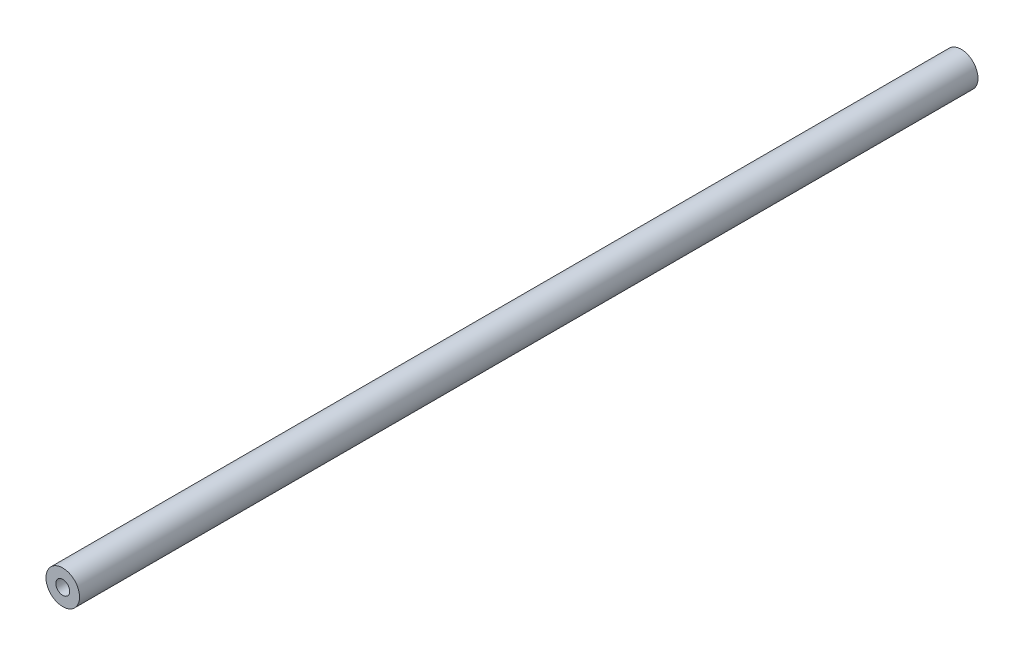
from build123d import *

# Parameters (mm, degrees)
SKETCH_1_R      = 4
EXTRUDE_1_DEPTH = 107
M4X0_71_D       = 3.3
M4X0_71_DEPTH   = 11
M4X0_71_TIP     = 0.991420021
M4X0_72_D       = 3.3
M4X0_72_DEPTH   = 11
M4X0_72_TIP     = 0.991420021


with BuildPart() as part:
    # Эскиз1 → Бобышка-Вытянуть1 (new, symmetric)
    with BuildSketch(Plane.XY):
        Circle(SKETCH_1_R)
    extrude(amount=EXTRUDE_1_DEPTH, both=True)

    # Отверстие обработанное метчиком M4x0.71
    with Locations(Plane(origin=(0, 0, -107), x_dir=(-1, 0, 0), z_dir=(0, 0, -1))):
        with Locations((0, 0)):
            Hole(M4X0_71_D / 2, depth=M4X0_71_DEPTH)
            with Locations((0, 0, -(M4X0_71_DEPTH + M4X0_71_TIP / 2))):  # 118° drill point
                Cone(0, M4X0_71_D / 2, M4X0_71_TIP, mode=Mode.SUBTRACT)

    # Отверстие обработанное метчиком M4x0.72
    with Locations(Plane.XY.offset(107)):
        with Locations((0, 0)):
            Hole(M4X0_72_D / 2, depth=M4X0_72_DEPTH)
            with Locations((0, 0, -(M4X0_72_DEPTH + M4X0_72_TIP / 2))):  # 118° drill point
                Cone(0, M4X0_72_D / 2, M4X0_72_TIP, mode=Mode.SUBTRACT)


solid = part.part
